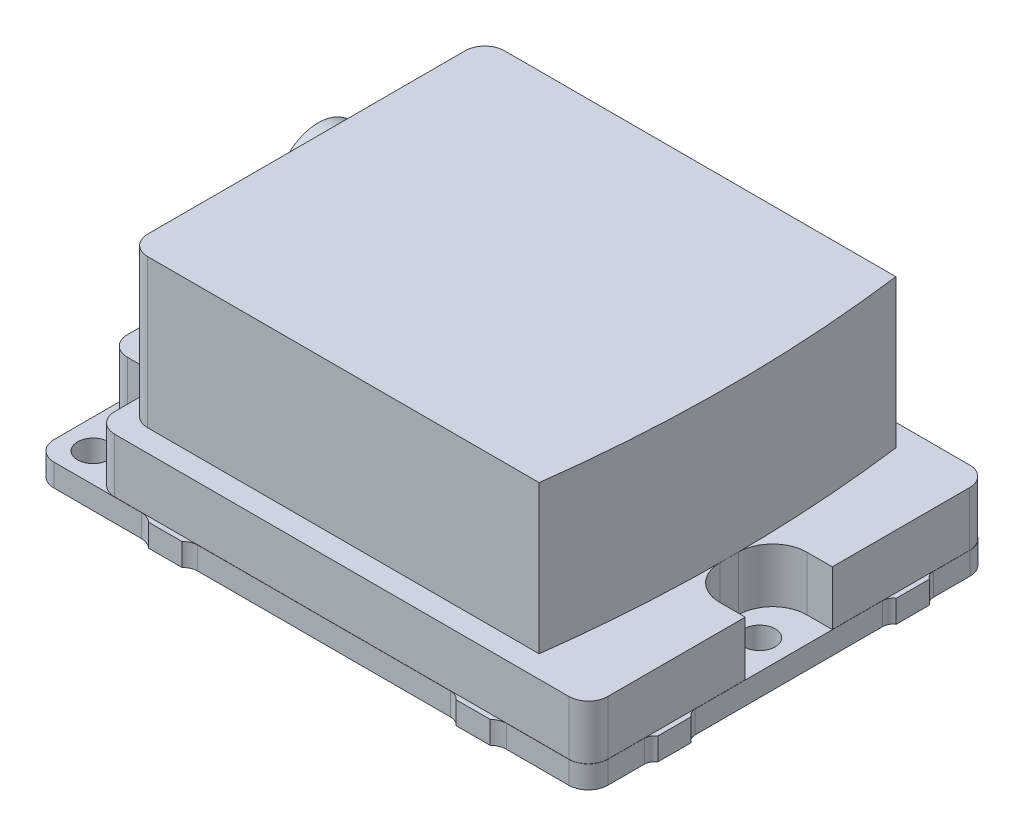
from build123d import *

# Parameters (mm, degrees)
SKETCH1_W               = 56.6
SKETCH1_H               = 41
BOSS_EXTRUDE1_DEPTH     = 2.3
BOSS_EXTRUDE2_DEPTH     = 5.55
BOSS_EXTRUDE3_DEPTH     = 15.15
FILLET1_R               = 2
BOSS_EXTRUDE5_DEPTH     = 2.3
BOSS_EXTRUDE6_DEPTH     = 2.3
SKETCH6_R               = 1.6
CUT_EXTRUDE1_DEPTH      = 42.199956917
FILLET2_R               = 3.5
SKETCH7_R               = 4.708157521
BOSS_EXTRUDE7_DEPTH     = 0.2
SKETCH11_R              = 4.425
BOSS_EXTRUDE8_DEPTH     = 2.45
CUT_EXTRUDE2_DEPTH      = 10
CUT_EXTRUDE2_DEPTH_BACK = 2.45
SKETCH12_R              = 3.925
BOSS_EXTRUDE10_DEPTH    = 1


with BuildPart() as part:
    # Sketch1 → Boss-Extrude1 (new body)
    with BuildSketch(Plane(origin=(0, 0, 0), x_dir=(1, 0, 0), z_dir=(0, 1, 0))):
        Rectangle(SKETCH1_W, SKETCH1_H)
    extrude(amount=BOSS_EXTRUDE1_DEPTH)

    # Sketch2 → Boss-Extrude2 (add)
    with BuildSketch(Plane(origin=(0, 2.3, 0), x_dir=(1, 0, 0), z_dir=(0, 1, 0))):
        Polygon((-22.125, -20.48), (28.285, -20.48), (28.285, -4.45), (22.185, -4.45), (22.185, 4.45), (28.285, 4.45), (28.285, 20.48), (-22.125, 20.48), (-22.125, 13.02), (-28.285, 13.02), (-28.285, -13.02), (-22.125, -13.02), align=None)
    extrude(amount=BOSS_EXTRUDE2_DEPTH)

    # Sketch3 → Boss-Extrude3 (add)
    with BuildSketch(Plane(origin=(0, 7.85, 0), x_dir=(1, 0, 0), z_dir=(0, 1, 0))):
        with BuildLine():
            Line((-19, -18.225), (21, -18.225))
            ThreePointArc((21, -18.225), (22.185, 0), (21, 18.225))
            Line((21, 18.225), (-19, 18.225))
            ThreePointArc((-19, 18.225), (-20.414213562, 17.639213562), (-21, 16.225))
            Line((-21, 16.225), (-21, -16.225))
            ThreePointArc((-21, -16.225), (-20.414213562, -17.639213562), (-19, -18.225))
        make_face()
    extrude(amount=BOSS_EXTRUDE3_DEPTH)

    # Fillet1
    fillet1_edges = [part.edges().sort_by_distance(p)[0] for p in [
        (28.285, 5.075, -20.48),
        (-22.125, 5.075, -20.48),
        (-22.125, 5.075, -13.02),
        (-28.285, 5.075, -13.02),
        (-28.285, 5.075, 13.02),
        (-22.125, 5.075, 13.02),
        (-22.125, 5.075, 20.48),
        (28.285, 5.075, 20.48),
        (28.3, 1.15, 20.5),
        (-28.3, 1.15, 20.5),
        (-28.3, 1.15, -20.5),
        (28.3, 1.15, -20.5),
    ]]
    fillet(fillet1_edges, radius=FILLET1_R)

    # Sketch4 → Boss-Extrude5 (add)
    with BuildSketch(Plane(origin=(0, 0, 0), x_dir=(1, 0, 0), z_dir=(0, 1, 0))):
        with BuildLine():
            Line((28.3, 14.772353725), (28.3, 9.587646275))
            ThreePointArc((28.3, 9.587646275), (28.429084519, 10.095465182), (28.785, 10.48))
            Line((28.785, 10.48), (28.785, 13.88))
            ThreePointArc((28.785, 13.88), (28.429084519, 14.264534818), (28.3, 14.772353725))
        make_face()
        with BuildLine():
            ThreePointArc((28.3, -9.587646275), (28.429084519, -10.095465182), (28.785, -10.48))
            Line((28.785, -10.48), (28.785, -13.88))
            ThreePointArc((28.785, -13.88), (28.429084519, -14.264534818), (28.3, -14.772353725))
            Line((28.3, -14.772353725), (28.3, -9.587646275))
        make_face()
    extrude(amount=BOSS_EXTRUDE5_DEPTH)

    # Sketch5 → Boss-Extrude6 (add)
    with BuildSketch(Plane(origin=(29.434734965, 0, -17.005006325), x_dir=(0, 0, -1), z_dir=(0, 1, 0))):
        with BuildLine():
            Line((3.494993675, 9.629302498), (3.494993675, 9.486266265))
            ThreePointArc((3.494993675, 9.486266265), (3.620682756, 10.143155137), (3.979993675, 10.707244136))
            Line((3.979993675, 10.707244136), (3.979993675, 14.149734965))
            ThreePointArc((3.979993675, 14.149734965), (3.621827878, 14.636664087), (3.494993675, 15.227676603))
            Line((3.494993675, 15.227676603), (3.494993675, 9.629302498))
        make_face()
        with BuildLine():
            Line((-37.505006325, 46.813203664), (-37.505006325, 46.670167432))
            Line((-37.505006325, 46.670167432), (-37.505006325, 41.071793326))
            ThreePointArc((-37.505006325, 41.071793326), (-37.631840527, 41.662805842), (-37.990006325, 42.149734965))
            Line((-37.990006325, 42.149734965), (-37.990006325, 45.592225793))
            ThreePointArc((-37.990006325, 45.592225793), (-37.630695406, 46.156314792), (-37.505006325, 46.813203664))
        make_face()
        with BuildLine():
            Line((3.494993675, 41.071793326), (3.494993675, 46.670167432))
            Line((3.494993675, 46.670167432), (3.494993675, 46.813203664))
            ThreePointArc((3.494993675, 46.813203664), (3.620682756, 46.156314792), (3.979993675, 45.592225793))
            Line((3.979993675, 45.592225793), (3.979993675, 42.149734965))
            ThreePointArc((3.979993675, 42.149734965), (3.621827878, 41.662805842), (3.494993675, 41.071793326))
        make_face()
        with BuildLine():
            Line((-37.505006325, 15.227676603), (-37.505006325, 9.629302498))
            Line((-37.505006325, 9.629302498), (-37.505006325, 9.486266265))
            ThreePointArc((-37.505006325, 9.486266265), (-37.630695406, 10.143155137), (-37.990006325, 10.707244136))
            Line((-37.990006325, 10.707244136), (-37.990006325, 14.149734965))
            ThreePointArc((-37.990006325, 14.149734965), (-37.631840527, 14.636664087), (-37.505006325, 15.227676603))
        make_face()
    extrude(amount=BOSS_EXTRUDE6_DEPTH)

    # Sketch6 → Cut-Extrude1 (cut, through all)
    with BuildSketch(Plane(origin=(0, 2.3, 0), x_dir=(1, 0, 0), z_dir=(0, 1, 0))):
        with Locations(Location((-25.3, 17.5, 0), (0, 0, 270))):
            Circle(SKETCH6_R)
        with Locations(Location((-25.3, -17.5, 0), (0, 0, 90))):
            Circle(SKETCH6_R)
        with Locations(Location((25.3, 0, 0), (0, 0, 270))):
            Circle(SKETCH6_R)
    extrude(amount=-CUT_EXTRUDE1_DEPTH, mode=Mode.SUBTRACT)

    # Fillet2
    fillet2_edges = [part.edges().sort_by_distance(p)[0] for p in [
        (22.185, 5.075, 4.45),
        (22.185, 5.075, -4.45),
    ]]
    fillet(fillet2_edges, radius=FILLET2_R)

    # Sketch7 → Boss-Extrude7 (add)
    with BuildSketch(Plane.ZY.offset(21)):
        with Locations(Location((7.06, 14.265, 0), (0, 0, 180))):
            Circle(SKETCH7_R)
    extrude(amount=BOSS_EXTRUDE7_DEPTH)

    # Sketch9 → Revolve1 (revolve)
    with BuildSketch(Plane(origin=(0, 0, -6.66), x_dir=(-1, 0, 0), z_dir=(0, 0, -1))):
        Polygon((21, 20.396842479), (21, 14.265), (24, 14.265), (24, 18.665), (22.15, 20.396842479), align=None)
    revolve(axis=Axis((-21, 14.265, -6.66), (-1, 0, 0)))

    # Sketch11 → Boss-Extrude8 (add)
    with BuildSketch(Plane.ZY.offset(24)):
        with Locations(Location((-6.66, 14.265, 0), (0, 0, 270))):
            Circle(SKETCH11_R)
    extrude(amount=BOSS_EXTRUDE8_DEPTH)

    # Sketch12 → Cut-Extrude2 (cut, two sides: drawn at the far end of the back side and taken through both)
    with BuildSketch(Plane.ZY.offset(26.45).offset(-CUT_EXTRUDE2_DEPTH_BACK)):
        with Locations(Location((-6.66, 14.265, 0), (0, 0, 270))):
            Circle(SKETCH12_R)
    extrude(amount=CUT_EXTRUDE2_DEPTH + CUT_EXTRUDE2_DEPTH_BACK, mode=Mode.SUBTRACT)

    # Sketch13 → Boss-Extrude10 (add)
    with BuildSketch(Plane.ZY.offset(21.2)):
        Polygon((2.351842479, 14.265), (4.705921239, 10.187615982), (9.414078761, 10.187615982), (11.768157521, 14.265), (9.414078761, 18.342384018), (4.705921239, 18.342384018), align=None)
    extrude(amount=BOSS_EXTRUDE10_DEPTH)


solid = part.part
